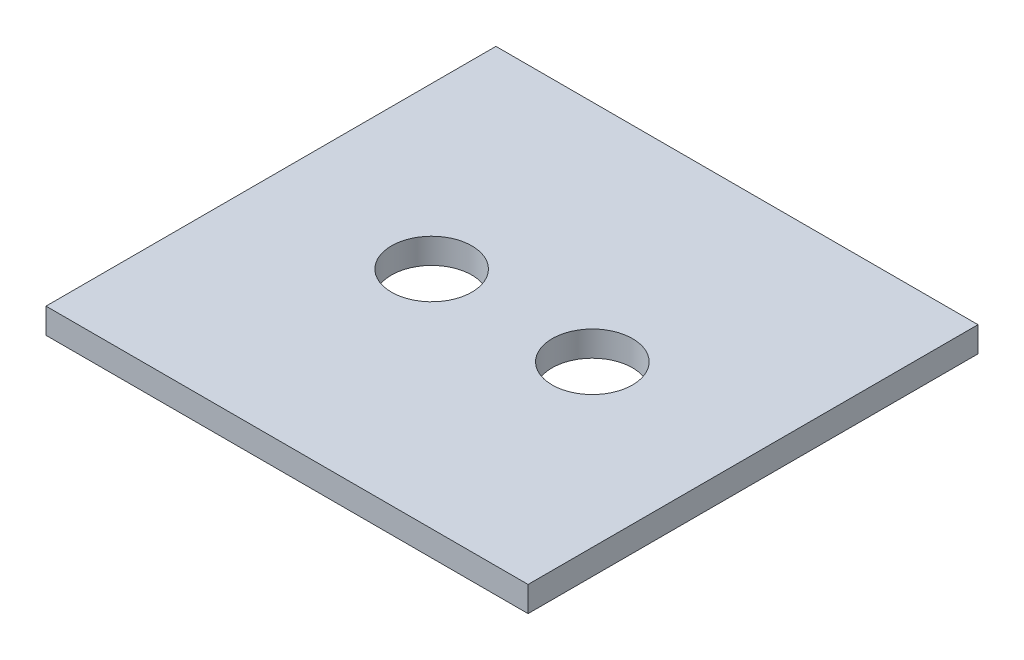
from build123d import *

# Parameters (mm, degrees)
SKETCH1_W           = 38.1
SKETCH1_H           = 35.56
SKETCH1_R           = 3.175
BOSS_EXTRUDE1_DEPTH = 2


with BuildPart() as part:
    # Sketch1 → Boss-Extrude1 (new body)
    with BuildSketch(Plane(origin=(0, 0, 0), x_dir=(1, 0, 0), z_dir=(0, 1, 0))):
        Rectangle(SKETCH1_W, SKETCH1_H)
        with Locations(Location((-6.35, 0, 0), (0, 0, 270))):
            Circle(SKETCH1_R, mode=Mode.SUBTRACT)
        with Locations(Location((6.35, 0, 0), (0, 0, 270))):
            Circle(SKETCH1_R, mode=Mode.SUBTRACT)
    extrude(amount=BOSS_EXTRUDE1_DEPTH)


solid = part.part
